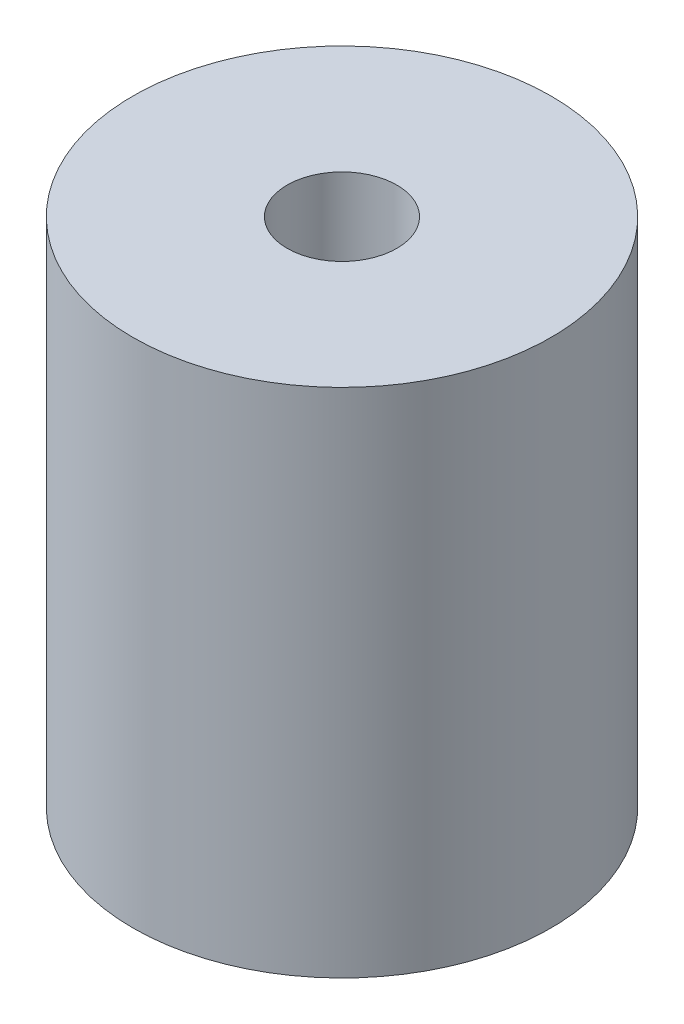
from build123d import *

# Parameters (mm, degrees)
SKETCH1_R             = 9.525
BOSS_EXTRUDE1_DEPTH   = 23.3
F_5_0MM_DOWEL_HOLE1_D = 5


with BuildPart() as part:
    # Sketch1 → Boss-Extrude1 (new body)
    with BuildSketch(Plane(origin=(0, 0, 0), x_dir=(1, 0, 0), z_dir=(0, 1, 0))):
        with Locations(Location((0, 0, 0), (0, 0, 270))):
            Circle(SKETCH1_R)
    extrude(amount=BOSS_EXTRUDE1_DEPTH)

    # Ø5.0mm Dowel Hole1 (through all)
    with Locations(Plane(origin=(0, 23.3, 0), x_dir=(1, 0, 0), z_dir=(0, 1, 0))):
        with Locations((0, 0)):
            Hole(F_5_0MM_DOWEL_HOLE1_D / 2)


solid = part.part
